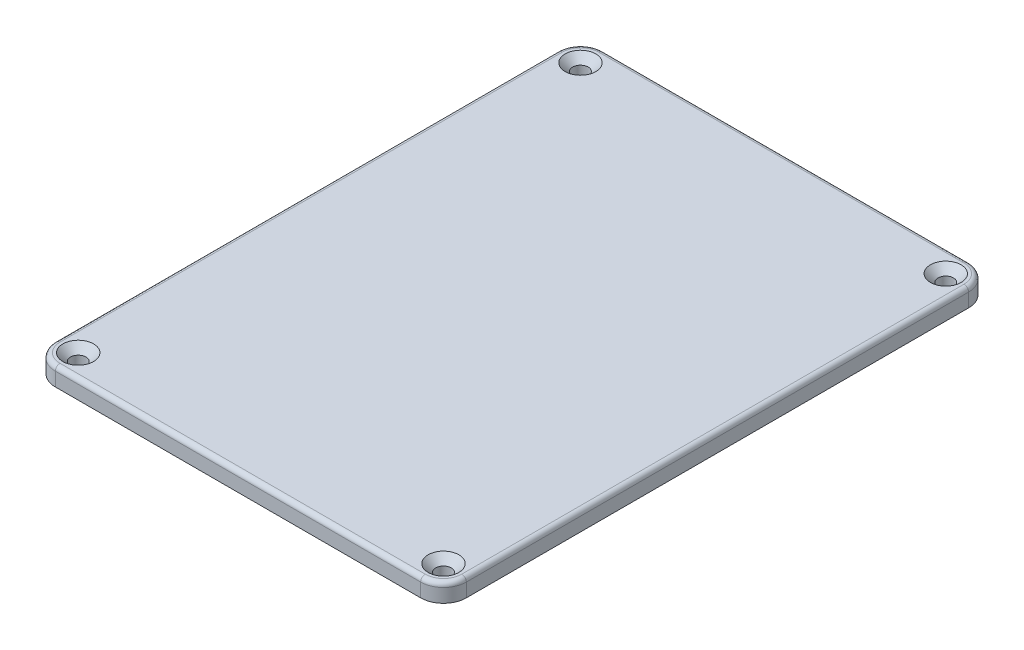
from build123d import *

# Parameters (mm, degrees)
SKETCH_2_W                  = 90
SKETCH_2_H                  = 120
EXTRUDE_1_DEPTH             = 3
SKETCH_3_W                  = 90
SKETCH_3_H                  = 120
EXTRUDE_2_DEPTH             = 1
HOLE_WIZARD_M3_3_AT_2_COUNT = 2
HOLE_WIZARD_M3_3_AT_2_PITCH = 110
HOLE_WIZARD_M3_3_AT_3_COUNT = 2
HOLE_WIZARD_M3_3_AT_3_PITCH = 136.014705087
HOLE_WIZARD_M3_3_AT_4_COUNT = 2
HOLE_WIZARD_M3_3_AT_4_PITCH = 80
FILLET_2_R                  = 5
FILLET_3_R                  = 5
FILLET_4_R                  = 5
FILLET_5_R                  = 5
FILLET_6_R                  = 5
FILLET_7_R                  = 5
FILLET_8_R                  = 5
FILLET_9_R                  = 5
FILLET_11_R                 = 1
SKETCH_18_R                 = 3
EXTRUDE_5_DEPTH             = 1
SKETCH_19_R                 = 2
CUT_EXTRUDE_1_DEPTH         = 3.1


with BuildPart() as part:
    # 草图2 → 凸台-拉伸1 (new body)
    with BuildSketch(Plane(origin=(0, 0, 0), x_dir=(1, 0, 0), z_dir=(0, 1, 0))):
        Rectangle(SKETCH_2_W, SKETCH_2_H)
    extrude(amount=EXTRUDE_1_DEPTH)


with BuildPart() as body_2:
    # 草图3 → 凸台-拉伸2 (new body)
    with BuildSketch(Plane.XZ):
        Rectangle(SKETCH_3_W, SKETCH_3_H)
        Polygon((-42, -50), (-42, 50), (-35, 50), (-35, 57), (35, 57), (35, 50), (42, 50), (42, -50), (35, -50), (35, -57), (-35, -57), (-35, -50), align=None, mode=Mode.SUBTRACT)
    extrude(amount=EXTRUDE_2_DEPTH)


with BuildPart() as hole_wizard_m3_3_tool:
    # 草图15 → M3 六角凹锥坑螺钉的锥形沉头孔3 (revolve)
    with BuildSketch(Plane(origin=(-40, 3, 55), x_dir=(0, 0, 1), z_dir=(1, 0, 0))):
        Polygon((0, 0), (0, 4), (1.7, 4), (1.7, 1.66), (3.36, 0), align=None)
    hole_wizard_m3_3 = revolve(axis=Axis((-40, 9.35, 55), (0, -1, 0)))


with BuildPart() as part_1:
    add(part.part)

    # M3 六角凹锥坑螺钉的锥形沉头孔3: cut by hole_wizard_m3_3_tool
    add(hole_wizard_m3_3_tool.part, mode=Mode.SUBTRACT)


with BuildPart() as body_2_1:
    add(body_2.part)

    # M3 六角凹锥坑螺钉的锥形沉头孔3: cut by hole_wizard_m3_3_tool
    add(hole_wizard_m3_3_tool.part, mode=Mode.SUBTRACT)


with BuildPart() as hole_wizard_m3_3_at_2_tool:
    # M3 六角凹锥坑螺钉的锥形沉头孔3 at 2: M3 六角凹锥坑螺钉的锥形沉头孔3 ×2
    with Locations(*[(0, 0, -i * HOLE_WIZARD_M3_3_AT_2_PITCH) for i in range(1, HOLE_WIZARD_M3_3_AT_2_COUNT)]):
        add(hole_wizard_m3_3)


with BuildPart() as part_2:
    add(part_1.part)

    # M3 六角凹锥坑螺钉的锥形沉头孔3 at 2: cut by hole_wizard_m3_3_at_2_tool
    add(hole_wizard_m3_3_at_2_tool.part, mode=Mode.SUBTRACT)


with BuildPart() as body_2_2:
    add(body_2_1.part)

    # M3 六角凹锥坑螺钉的锥形沉头孔3 at 2: cut by hole_wizard_m3_3_at_2_tool
    add(hole_wizard_m3_3_at_2_tool.part, mode=Mode.SUBTRACT)


with BuildPart() as hole_wizard_m3_3_at_3_tool:
    # M3 六角凹锥坑螺钉的锥形沉头孔3 at 3: M3 六角凹锥坑螺钉的锥形沉头孔3 ×2
    with Locations(*[Vector(0.5881716976750462, 0, -0.8087360843031886) * (i * HOLE_WIZARD_M3_3_AT_3_PITCH) for i in range(1, HOLE_WIZARD_M3_3_AT_3_COUNT)]):
        add(hole_wizard_m3_3)


with BuildPart() as part_3:
    add(part_2.part)

    # M3 六角凹锥坑螺钉的锥形沉头孔3 at 3: cut by hole_wizard_m3_3_at_3_tool
    add(hole_wizard_m3_3_at_3_tool.part, mode=Mode.SUBTRACT)


with BuildPart() as body_2_3:
    add(body_2_2.part)

    # M3 六角凹锥坑螺钉的锥形沉头孔3 at 3: cut by hole_wizard_m3_3_at_3_tool
    add(hole_wizard_m3_3_at_3_tool.part, mode=Mode.SUBTRACT)


with BuildPart() as hole_wizard_m3_3_at_4_tool:
    # M3 六角凹锥坑螺钉的锥形沉头孔3 at 4: M3 六角凹锥坑螺钉的锥形沉头孔3 ×2
    with Locations(*[(i * HOLE_WIZARD_M3_3_AT_4_PITCH, 0, 0) for i in range(1, HOLE_WIZARD_M3_3_AT_4_COUNT)]):
        add(hole_wizard_m3_3)


with BuildPart() as part_4:
    add(part_3.part)

    # M3 六角凹锥坑螺钉的锥形沉头孔3 at 4: cut by hole_wizard_m3_3_at_4_tool
    add(hole_wizard_m3_3_at_4_tool.part, mode=Mode.SUBTRACT)


with BuildPart() as body_2_4:
    add(body_2_3.part)

    # M3 六角凹锥坑螺钉的锥形沉头孔3 at 4: cut by hole_wizard_m3_3_at_4_tool
    add(hole_wizard_m3_3_at_4_tool.part, mode=Mode.SUBTRACT)

    # Combine 2: union part
    add(part_4.part)

    # 圆角2
    fillet_2_edges = [body_2_4.edges().sort_by_distance(p)[0] for p in [
        (35, -0.5, -50),
    ]]
    fillet(fillet_2_edges, radius=FILLET_2_R)

    # 圆角3
    fillet_3_edges = [body_2_4.edges().sort_by_distance(p)[0] for p in [
        (-35, -0.5, -50),
    ]]
    fillet(fillet_3_edges, radius=FILLET_3_R)

    # 圆角4
    fillet_4_edges = [body_2_4.edges().sort_by_distance(p)[0] for p in [
        (35, -0.5, 50),
    ]]
    fillet(fillet_4_edges, radius=FILLET_4_R)

    # 圆角5
    fillet_5_edges = [body_2_4.edges().sort_by_distance(p)[0] for p in [
        (-35, -0.5, 50),
    ]]
    fillet(fillet_5_edges, radius=FILLET_5_R)

    # 圆角6
    fillet_6_edges = [body_2_4.edges().sort_by_distance(p)[0] for p in [
        (-45, 1, -60),
    ]]
    fillet(fillet_6_edges, radius=FILLET_6_R)

    # 圆角7
    fillet_7_edges = [body_2_4.edges().sort_by_distance(p)[0] for p in [
        (45, 1, -60),
    ]]
    fillet(fillet_7_edges, radius=FILLET_7_R)

    # 圆角8
    fillet_8_edges = [body_2_4.edges().sort_by_distance(p)[0] for p in [
        (45, 1, 60),
    ]]
    fillet(fillet_8_edges, radius=FILLET_8_R)

    # 圆角9
    fillet_9_edges = [body_2_4.edges().sort_by_distance(p)[0] for p in [
        (-45, 1, 60),
    ]]
    fillet(fillet_9_edges, radius=FILLET_9_R)

    # 圆角11
    fillet_11_edges = [body_2_4.edges().sort_by_distance(p)[0] for p in [
        (-45, 3, 0),
        (-43.535533906, 3, -58.535533906),
        (0, 3, -60),
        (43.535533906, 3, -58.535533906),
        (45, 3, 0),
        (43.535533906, 3, 58.535533906),
        (0, 3, 60),
        (-43.535533906, 3, 58.535533906),
    ]]
    fillet(fillet_11_edges, radius=FILLET_11_R)

    # 草图18 → 凸台-拉伸5 (add)
    with BuildSketch(Plane.XZ):
        with Locations(Location((-37, 29, 0), (0, 0, 90))):
            Circle(SKETCH_18_R)
        with Locations(Location((37, 29, 0), (0, 0, 90))):
            Circle(SKETCH_18_R)
        with Locations(Location((0, 18, 0), (0, 0, 90))):
            Circle(SKETCH_18_R)
        with Locations(Location((-37, -41, 0), (0, 0, 90))):
            Circle(SKETCH_18_R)
        with Locations(Location((37, -41, 0), (0, 0, 90))):
            Circle(SKETCH_18_R)
    extrude(amount=EXTRUDE_5_DEPTH)

    # 草图19 → 切除-拉伸1 (cut)
    with BuildSketch(Plane.XZ.offset(1)):
        with Locations(Location((-37, 29, 0), (0, 0, 270))):
            Circle(SKETCH_19_R)
        with Locations(Location((37, 29, 0), (0, 0, 270))):
            Circle(SKETCH_19_R)
        with Locations(Location((0, 18, 0), (0, 0, 270))):
            Circle(SKETCH_19_R)
        with Locations(Location((-37, -41, 0), (0, 0, 270))):
            Circle(SKETCH_19_R)
        with Locations(Location((37, -41, 0), (0, 0, 270))):
            Circle(SKETCH_19_R)
    extrude(amount=-CUT_EXTRUDE_1_DEPTH, mode=Mode.SUBTRACT)


solid = body_2_4.part
